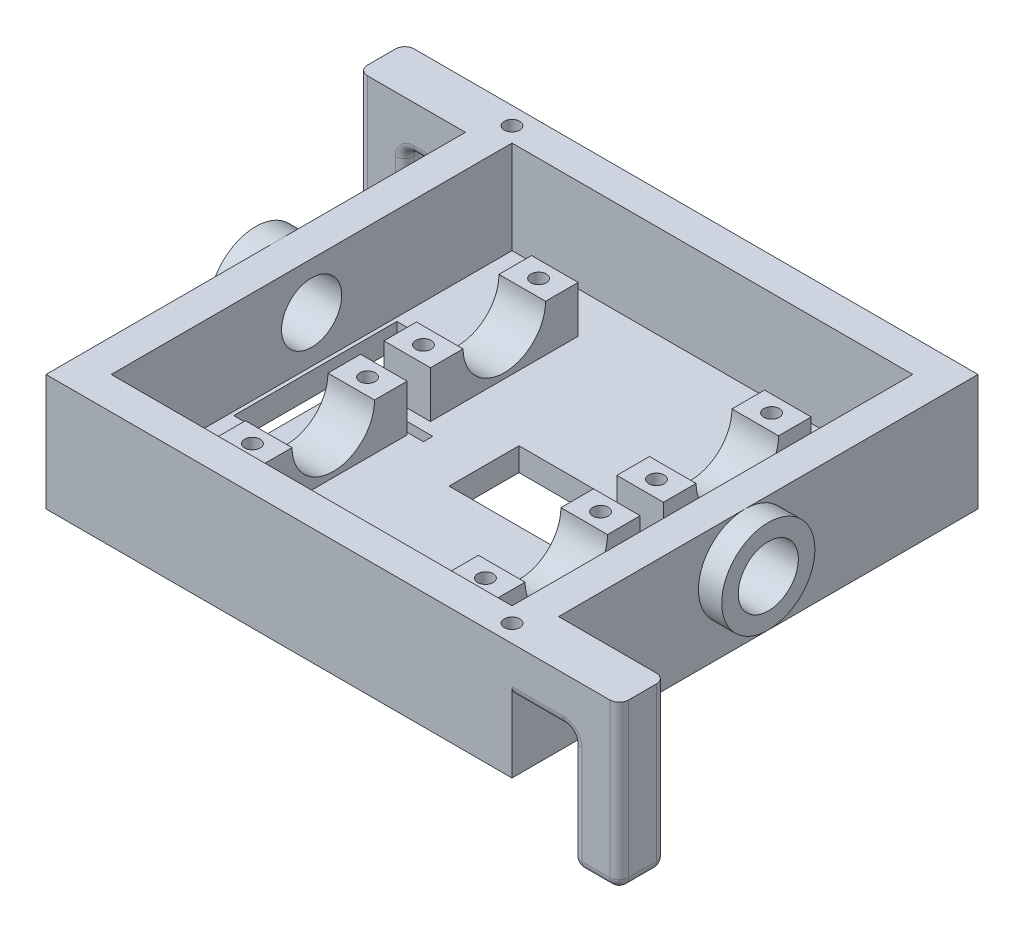
from build123d import *

# Parameters (mm, degrees)
SKETCH1_W               = 127
SKETCH1_H               = 127
BOSS_EXTRUDE1_DEPTH     = 6.35
BOSS_EXTRUDE2_DEPTH     = 6.35
BOSS_EXTRUDE3_DEPTH     = 6.35
SKETCH6_W               = 127
SKETCH6_H               = 25.4
BOSS_EXTRUDE4_DEPTH     = 8.89
SKETCH7_R               = 8.1915
CUT_EXTRUDE1_DEPTH      = 8.89
SKETCH8_W               = 109.22
SKETCH8_H               = 25.4
BOSS_EXTRUDE5_DEPTH     = 8.89
SKETCH9_W               = 12.7
SKETCH9_H               = 12.7
BOSS_EXTRUDE6_DEPTH     = 29.21
SKETCH10_W              = 12.7
SKETCH10_H              = 12.7
BOSS_EXTRUDE7_DEPTH     = 31.75
MIRROR5_COPY_1_SKETCH_W = 12.7
MIRROR5_COPY_1_SKETCH_H = 12.7
MIRROR5_COPY_1_DEPTH    = 29.21
MIRROR5_COPY_2_SKETCH_W = 12.7
MIRROR5_COPY_2_SKETCH_H = 12.7
MIRROR5_COPY_2_DEPTH    = 31.75
FILLET1_R               = 2.54
SKETCH11_W              = 29.21
SKETCH11_H              = 19.05
CUT_EXTRUDE2_DEPTH      = 6.35
SKETCH12_R              = 12.7
SKETCH12_R_2            = 8.1915
BOSS_EXTRUDE8_DEPTH     = 6.35
SKETCH13_R              = 2.1
CUT_EXTRUDE3_DEPTH      = 12.7
MIRROR8_COPY_1_SKETCH_R = 2.1
MIRROR8_COPY_1_DEPTH    = 12.7
SKETCH14_R              = 2.1
CUT_EXTRUDE4_DEPTH      = 25.4
SKETCH15_W              = 8.89
SKETCH15_H              = 44.45
CUT_EXTRUDE5_DEPTH      = 6.35
SKETCH16_W              = 12.7
SKETCH16_H              = 2.54
CUT_EXTRUDE6_DEPTH      = 6.35
CUT_EXTRUDE7_REACH      = 173.586
SKETCH18_W              = 50.530596201
SKETCH18_H              = 73.67869055
SKETCH19_W              = 46.387649415
SKETCH19_H              = 80.970556506
CUT_EXTRUDE8_DEPTH      = 29.21


with BuildPart() as part:
    # Sketch1 → Boss-Extrude1 (new body)
    with BuildSketch(Plane(origin=(0, 0, 0), x_dir=(1, 0, 0), z_dir=(0, 1, 0))):
        Rectangle(SKETCH1_W, SKETCH1_H)
    extrude(amount=BOSS_EXTRUDE1_DEPTH)

    # Sketch3 → Boss-Extrude2 (add, symmetric)
    with BuildSketch(Plane(origin=(31.75, 0, 0), x_dir=(0, 0, -1), z_dir=(1, 0, 0))):
        with BuildLine():
            Line((-43.434, 6.35), (-3.175, 6.35))
            Line((-3.175, 6.35), (-3.175, 19.05))
            Line((-3.175, 19.05), (-12.065, 19.05))
            ThreePointArc((-12.065, 19.05), (-23.3045, 7.8105), (-34.544, 19.05))
            Line((-34.544, 19.05), (-43.434, 19.05))
            Line((-43.434, 19.05), (-43.434, 6.35))
        make_face()
    boss_extrude2 = extrude(amount=BOSS_EXTRUDE2_DEPTH, both=True)

    # Sketch5 → Boss-Extrude3 (add, symmetric)
    with BuildSketch(Plane(origin=(-31.75, 0, 0), x_dir=(0, 0, -1), z_dir=(1, 0, 0))):
        with BuildLine():
            Line((-43.434, 6.35), (-3.175, 6.35))
            Line((-3.175, 6.35), (-3.175, 19.05))
            Line((-3.175, 19.05), (-12.065, 19.05))
            ThreePointArc((-12.065, 19.05), (-23.3045, 7.8105), (-34.544, 19.05))
            Line((-34.544, 19.05), (-43.434, 19.05))
            Line((-43.434, 19.05), (-43.434, 6.35))
        make_face()
    boss_extrude3 = extrude(amount=BOSS_EXTRUDE3_DEPTH, both=True)

    # Mirror1: Boss-Extrude2, Boss-Extrude3 across plane
    add(boss_extrude2.mirror(Plane.XY))
    add(boss_extrude3.mirror(Plane.XY))

    # Sketch6 → Boss-Extrude4 (add)
    with BuildSketch(Plane(origin=(63.5, 0, 0), x_dir=(0, 0, -1), z_dir=(1, 0, 0))):
        with Locations((0, 19.05)):
            Rectangle(SKETCH6_W, SKETCH6_H)
    boss_extrude4 = extrude(amount=-BOSS_EXTRUDE4_DEPTH)

    # Sketch7 → Cut-Extrude1 (cut)
    with BuildSketch(Plane.ZY.offset(-54.61)):
        with Locations((0, 19.05)):
            Circle(SKETCH7_R)
    cut_extrude1 = extrude(amount=-CUT_EXTRUDE1_DEPTH, mode=Mode.SUBTRACT)

    # Mirror2: Boss-Extrude4, Cut-Extrude1 across plane
    add(boss_extrude4.mirror(Plane(origin=(0, 0, 0), x_dir=(0, 0, 1), z_dir=(1, 0, 0))))
    add(cut_extrude1.mirror(Plane(origin=(0, 0, 0), x_dir=(0, 0, 1), z_dir=(1, 0, 0))), mode=Mode.SUBTRACT)

    # Sketch8 → Boss-Extrude5 (add)
    with BuildSketch(Plane(origin=(0, 0, -63.5), x_dir=(-1, 0, 0), z_dir=(0, 0, -1))):
        with Locations((0, 19.05)):
            Rectangle(SKETCH8_W, SKETCH8_H)
    boss_extrude5 = extrude(amount=-BOSS_EXTRUDE5_DEPTH)

    # Mirror3: Boss-Extrude5 across plane
    add(boss_extrude5.mirror(Plane.XY))

    # Sketch9 → Boss-Extrude6 (add)
    with BuildSketch(Plane(origin=(63.5, 0, 0), x_dir=(0, 0, -1), z_dir=(1, 0, 0))):
        with Locations((57.15, 25.4)):
            Rectangle(SKETCH9_W, SKETCH9_H)
    boss_extrude6 = extrude(amount=BOSS_EXTRUDE6_DEPTH)

    # Sketch10 → Boss-Extrude7 (add)
    with BuildSketch(Plane.XZ.offset(-19.05)):
        with Locations((86.36, -57.15)):
            Rectangle(SKETCH10_W, SKETCH10_H)
    boss_extrude7 = extrude(amount=BOSS_EXTRUDE7_DEPTH)

    # Mirror4: Boss-Extrude6, Boss-Extrude7 across plane
    add(boss_extrude6.mirror(Plane.XY))
    add(boss_extrude7.mirror(Plane.XY))

    # Mirror5: Boss-Extrude6, Boss-Extrude7 across plane
    add(boss_extrude6.mirror(Plane(origin=(0, 0, 0), x_dir=(0, 0, 1), z_dir=(1, 0, 0))))
    add(boss_extrude7.mirror(Plane(origin=(0, 0, 0), x_dir=(0, 0, 1), z_dir=(1, 0, 0))))

    # Mirror5 copy 1 sketch → Mirror5 copy 1 (add)
    with BuildSketch(Plane.ZY.offset(63.5)):
        with Locations((57.15, 25.4)):
            Rectangle(MIRROR5_COPY_1_SKETCH_W, MIRROR5_COPY_1_SKETCH_H)
    extrude(amount=MIRROR5_COPY_1_DEPTH)

    # Mirror5 copy 2 sketch → Mirror5 copy 2 (add)
    with BuildSketch(Plane(origin=(0, 19.05, 0), x_dir=(-1, 0, 0), z_dir=(0, -1, 0))):
        with Locations((86.36, -57.15)):
            Rectangle(MIRROR5_COPY_2_SKETCH_W, MIRROR5_COPY_2_SKETCH_H)
    extrude(amount=MIRROR5_COPY_2_DEPTH)

    # Fillet1
    fillet1_edges = [part.edges().sort_by_distance(p)[0] for p in [
        (92.71, 9.525, -63.5),
        (92.71, 9.525, -50.8),
        (71.755, 19.05, -63.5),
        (71.755, 19.05, -50.8),
        (80.01, 19.05, -57.15),
        (80.01, 3.175, -50.8),
        (80.01, 3.175, -63.5),
        (92.71, -12.7, -57.15),
        (86.36, -12.7, -50.8),
        (80.01, -12.7, -57.15),
        (86.36, -12.7, -63.5),
        (92.71, 9.525, 63.5),
        (92.71, 9.525, 50.8),
        (71.755, 19.05, 50.8),
        (71.755, 19.05, 63.5),
        (92.71, -12.7, 57.15),
        (86.36, -12.7, 63.5),
        (80.01, -12.7, 57.15),
        (80.01, 3.175, 63.5),
        (86.36, -12.7, 50.8),
        (80.01, 3.175, 50.8),
        (80.01, 19.05, 57.15),
        (-92.71, 9.525, -63.5),
        (-92.71, 9.525, -50.8),
        (-71.755, 19.05, -50.8),
        (-71.755, 19.05, -63.5),
        (-92.71, -12.7, -57.15),
        (-86.36, -12.7, -63.5),
        (-80.01, -12.7, -57.15),
        (-80.01, 3.175, -63.5),
        (-86.36, -12.7, -50.8),
        (-80.01, 3.175, -50.8),
        (-80.01, 19.05, -57.15),
        (-92.71, 9.525, 63.5),
        (-92.71, 9.525, 50.8),
        (-71.755, 19.05, 63.5),
        (-71.755, 19.05, 50.8),
        (-80.01, 19.05, 57.15),
        (-80.01, 3.175, 50.8),
        (-80.01, 3.175, 63.5),
        (-92.71, -12.7, 57.15),
        (-86.36, -12.7, 50.8),
        (-80.01, -12.7, 57.15),
        (-86.36, -12.7, 63.5),
    ]]
    fillet(fillet1_edges, radius=FILLET1_R)

    # Sketch11 → Cut-Extrude2 (cut)
    with BuildSketch(Plane(origin=(0, 6.35, 0), x_dir=(1, 0, 0), z_dir=(0, 1, 0))):
        with Locations((6.985, 0)):
            Rectangle(SKETCH11_W, SKETCH11_H)
    extrude(amount=-CUT_EXTRUDE2_DEPTH, mode=Mode.SUBTRACT)

    # Sketch12 → Boss-Extrude8 (add)
    with BuildSketch(Plane(origin=(63.5, 0, 0), x_dir=(0, 0, -1), z_dir=(1, 0, 0))):
        with Locations(Location((0, 19.05, 0), (0, 0, 90))):
            Circle(SKETCH12_R)
        with Locations(Location((0, 19.05, 0), (0, 0, 180))):
            Circle(SKETCH12_R_2, mode=Mode.SUBTRACT)
    boss_extrude8 = extrude(amount=BOSS_EXTRUDE8_DEPTH)

    # Mirror6: Boss-Extrude8 across plane
    add(boss_extrude8.mirror(Plane(origin=(0, 0, 0), x_dir=(0, 0, 1), z_dir=(1, 0, 0))))

    # Sketch13 → Cut-Extrude3 (cut)
    with BuildSketch(Plane(origin=(0, 19.05, 0), x_dir=(1, 0, 0), z_dir=(0, 1, 0))):
        with Locations(Location((31.75, -38.989, 0), (0, 0, 270))):
            Circle(SKETCH13_R)
        with Locations(Location((31.75, -7.62, 0), (0, 0, 270))):
            Circle(SKETCH13_R)
    cut_extrude3 = extrude(amount=-CUT_EXTRUDE3_DEPTH, mode=Mode.SUBTRACT)

    # Mirror7: Cut-Extrude3 across plane
    add(cut_extrude3.mirror(Plane.XY), mode=Mode.SUBTRACT)

    # Mirror8: Cut-Extrude3 across plane
    add(cut_extrude3.mirror(Plane(origin=(0, 0, 0), x_dir=(0, 0, 1), z_dir=(1, 0, 0))), mode=Mode.SUBTRACT)

    # Mirror8 copy 1 sketch → Mirror8 copy 1 (cut)
    with BuildSketch(Plane(origin=(0, 19.05, 0), x_dir=(-1, 0, 0), z_dir=(0, 1, 0))):
        with Locations(Location((31.75, -38.989, 0), (0, 0, 270))):
            Circle(MIRROR8_COPY_1_SKETCH_R)
        with Locations(Location((31.75, -7.62, 0), (0, 0, 270))):
            Circle(MIRROR8_COPY_1_SKETCH_R)
    extrude(amount=-MIRROR8_COPY_1_DEPTH, mode=Mode.SUBTRACT)

    # Sketch14 → Cut-Extrude4 (cut)
    with BuildSketch(Plane(origin=(0, 31.75, 0), x_dir=(1, 0, 0), z_dir=(0, 1, 0))):
        with Locations(Location((-58.71, 58.71, 0), (0, 0, 270))):
            Circle(SKETCH14_R)
        with Locations(Location((58.71, -58.71, 0), (0, 0, 270))):
            Circle(SKETCH14_R)
    extrude(amount=-CUT_EXTRUDE4_DEPTH, mode=Mode.SUBTRACT)

    # Sketch15 → Cut-Extrude5 (cut)
    with BuildSketch(Plane(origin=(0, 6.35, 0), x_dir=(1, 0, 0), z_dir=(0, 1, 0))):
        with Locations((49.165, 0)):
            Rectangle(SKETCH15_W, SKETCH15_H)
    cut_extrude5 = extrude(amount=-CUT_EXTRUDE5_DEPTH, mode=Mode.SUBTRACT)

    # Mirror9: Cut-Extrude5 across plane
    add(cut_extrude5.mirror(Plane(origin=(0, 0, 0), x_dir=(0, 0, 1), z_dir=(1, 0, 0))), mode=Mode.SUBTRACT)

    # Sketch16 → Cut-Extrude6 (cut)
    with BuildSketch(Plane(origin=(0, 6.35, 0), x_dir=(1, 0, 0), z_dir=(0, 1, 0))):
        with Locations((-27.94, -1.27)):
            Rectangle(SKETCH16_W, SKETCH16_H)
    extrude(amount=-CUT_EXTRUDE6_DEPTH, mode=Mode.SUBTRACT)

    # Sketch18 → Cut-Extrude7 (cut, up to next)
    with BuildSketch(Plane.ZY.offset(63.5), mode=Mode.PRIVATE) as cut_extrude7_sk1:
        with Locations((60.834321125, 15.733047456)):
            Rectangle(SKETCH18_W, SKETCH18_H)
    cut_extrude7_tool1 = extrude(cut_extrude7_sk1.sketch, amount=CUT_EXTRUDE7_REACH, mode=Mode.PRIVATE) & part.part
    add(cut_extrude7_tool1.solids().sort_by_distance((-63.5, 15.733047, 60.834321))[0], mode=Mode.SUBTRACT)

    # Sketch19 → Cut-Extrude8 (cut)
    with BuildSketch(Plane(origin=(63.5, 0, 0), x_dir=(0, 0, -1), z_dir=(1, 0, 0))):
        with Locations((60.941888133, 13.904143716)):
            Rectangle(SKETCH19_W, SKETCH19_H)
    extrude(amount=CUT_EXTRUDE8_DEPTH, mode=Mode.SUBTRACT)


solid = part.part
